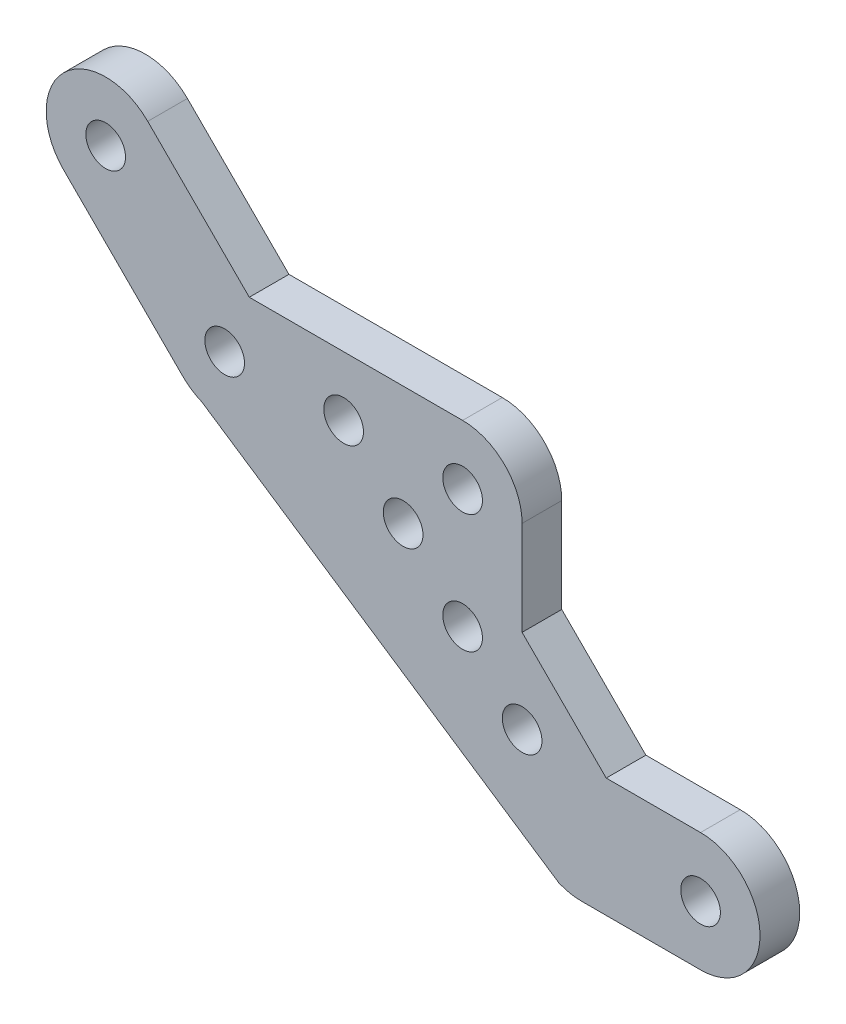
from build123d import *

# Parameters (mm, degrees)
MODEL_R                 = 1.5
SALIENTE_EXTRUIR1_DEPTH = 3


with BuildPart() as part:
    # Model → Saliente-Extruir1 (new body)
    with BuildSketch(Plane.XY):
        with BuildLine():
            ThreePointArc((420.095665246, 187.552102229), (420.777579713, 186.992469489), (421.555570316, 186.576624848))
            Line((421.555570316, 186.576624848), (447.102329028, 169.545452373))
            Line((447.102329028, 169.545452373), (448.555570316, 168.576624848))
            ThreePointArc((448.555570316, 168.576624848), (449.399739312, 168.320548983), (450.277645761, 168.234082745))
            Line((450.277645761, 168.234082745), (459.277645761, 168.234082745))
            ThreePointArc((459.277645761, 168.234082745), (463.777645761, 172.734082745), (459.277645761, 177.234082745))
            Line((459.277645761, 177.234082745), (452.141606792, 177.234082745))
            Line((452.141606792, 177.234082745), (445.777645761, 183.598043775))
            Line((445.777645761, 183.598043775), (445.777645761, 190.734082745))
            ThreePointArc((445.777645761, 190.734082745), (444.459626276, 193.91606326), (441.277645761, 195.234082745))
            Line((441.277645761, 195.234082745), (425.141606792, 195.234082745))
            Line((425.141606792, 195.234082745), (417.459626276, 202.91606326))
            ThreePointArc((417.459626276, 202.91606326), (411.095665246, 202.91606326), (411.095665246, 196.552102229))
            Line((411.095665246, 196.552102229), (420.095665246, 187.552102229))
        make_face()
        with Locations((459.277645761, 172.734082745)):
            Circle(MODEL_R, mode=Mode.SUBTRACT)
        with Locations((445.777645761, 177.234082745)):
            Circle(MODEL_R, mode=Mode.SUBTRACT)
        with Locations((441.277645761, 181.734082745)):
            Circle(MODEL_R, mode=Mode.SUBTRACT)
        with Locations((423.277645761, 190.734082745)):
            Circle(MODEL_R, mode=Mode.SUBTRACT)
        with Locations((436.777645761, 186.234082745)):
            Circle(MODEL_R, mode=Mode.SUBTRACT)
        with Locations((432.277645761, 190.734082745)):
            Circle(MODEL_R, mode=Mode.SUBTRACT)
        with Locations((414.277645761, 199.734082745)):
            Circle(MODEL_R, mode=Mode.SUBTRACT)
        with Locations((441.277645761, 190.734082745)):
            Circle(MODEL_R, mode=Mode.SUBTRACT)
    extrude(amount=SALIENTE_EXTRUIR1_DEPTH)


solid = part.part
